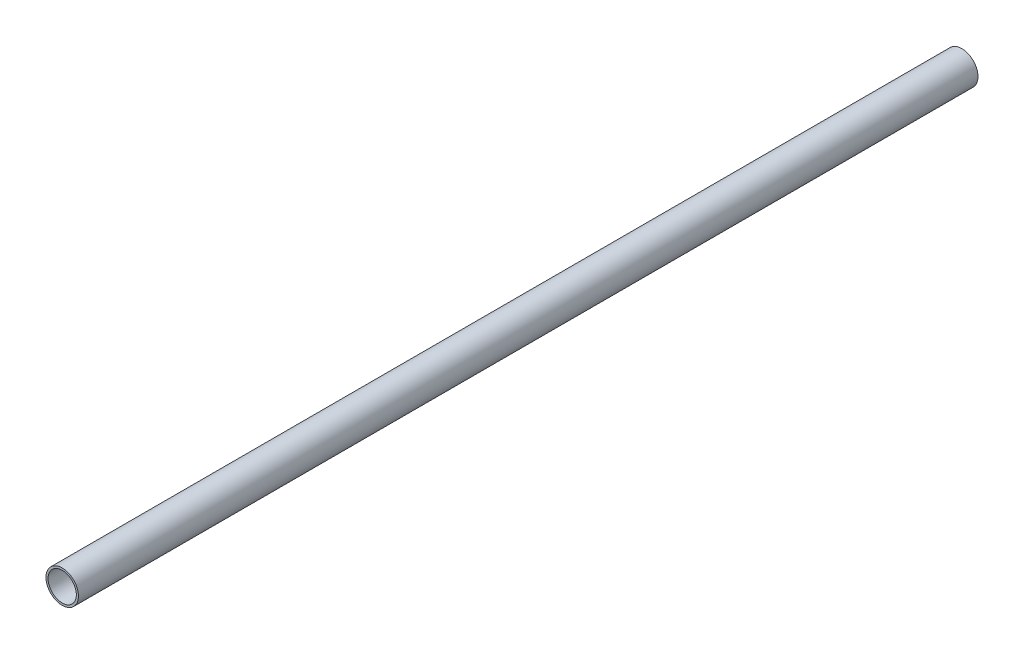
from build123d import *

# Parameters (mm, degrees)
SKETCH1_R           = 7.9375
SKETCH1_R_2         = 6.9215
BOSS_EXTRUDE1_DEPTH = 220


with BuildPart() as part:
    # Sketch1 → Boss-Extrude1 (new, symmetric)
    with BuildSketch(Plane.XY):
        Circle(SKETCH1_R)
        Circle(SKETCH1_R_2, mode=Mode.SUBTRACT)
    extrude(amount=BOSS_EXTRUDE1_DEPTH, both=True)


solid = part.part
